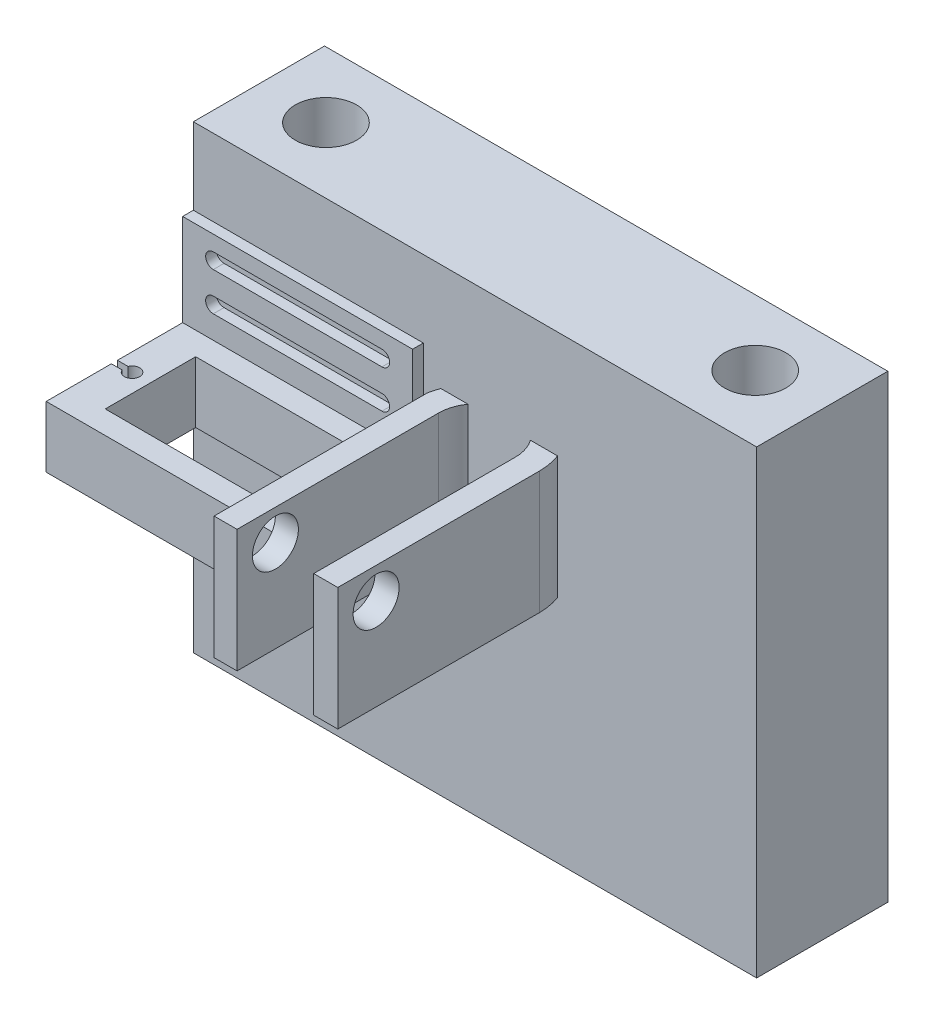
from build123d import *

# Parameters (mm, degrees)
SKETCH1_W                   = 31.9
SKETCH1_H                   = 17.8
SKETCH1_W_2                 = 22.5
SKETCH1_H_2                 = 11.8
BOSS_EXTRUDE1_DEPTH         = 8
BOSS_EXTRUDE2_DEPTH         = 16
SKETCH5_W                   = 14.05
SKETCH5_H                   = 12
SKETCH5_W_2                 = 15.95
SKETCH5_H_2                 = 8
BOSS_EXTRUDE3_DEPTH         = 3
CUT_EXTRUDE2_DEPTH          = 3
CUT_EXTRUDE3_DEPTH          = 43.272216091
BOSS_EXTRUDE4_START         = -8
BOSS_EXTRUDE4_DEPTH         = 8
CUT_EXTRUDE4_DEPTH          = 43.128612605
IZIM1_W                     = 73.483837375
IZIM1_H                     = 17.110844689
IZIM1_R                     = 4
Y_KSEKLIK_EKSTR_ZYON1_DEPTH = 30


with BuildPart() as part:
    # Sketch1 → Boss-Extrude1 (new body)
    with BuildSketch(Plane(origin=(0, 0, 0), x_dir=(1, 0, 0), z_dir=(0, 1, 0))):
        Rectangle(SKETCH1_W, SKETCH1_H)
        Rectangle(SKETCH1_W_2, SKETCH1_H_2, mode=Mode.SUBTRACT)
    extrude(amount=BOSS_EXTRUDE1_DEPTH)

    # Sketch3 → Boss-Extrude2 (add)
    with BuildSketch(Plane.XZ):
        with BuildLine():
            ThreePointArc((28.95, -7.4), (23.95, -12.4), (18.95, -7.4))
            Line((18.95, -7.4), (18.95, 18.9))
            Line((18.95, 18.9), (15.95, 18.9))
            Line((15.95, 18.9), (15.95, -8.9))
            ThreePointArc((15.95, -8.9), (24.70323224, -15.504482784), (32.089410298, -7.4))
            Line((32.089410298, -7.4), (32.089410298, 18.9))
            Line((32.089410298, 18.9), (28.95, 18.9))
            Line((28.95, 18.9), (28.95, -7.4))
        make_face()
    extrude(amount=-BOSS_EXTRUDE2_DEPTH)

    # Sketch5 → Boss-Extrude3 (add)
    with BuildSketch(Plane(origin=(0, 0, -8.9), x_dir=(-1, 0, 0), z_dir=(0, 0, -1))):
        with Locations((-7.025, 14)):
            Rectangle(SKETCH5_W, SKETCH5_H)
        with Locations((7.975, 14)):
            Rectangle(SKETCH5_W_2, SKETCH5_H)
        with Locations((7.975, 4)):
            Rectangle(SKETCH5_W_2, SKETCH5_H_2)
        with Locations((-7.025, 4)):
            Rectangle(SKETCH5_W, SKETCH5_H_2)
    extrude(amount=BOSS_EXTRUDE3_DEPTH)

    # Sketch6 → Cut-Extrude2 (cut)
    with BuildSketch(Plane.XY.offset(-8.9)):
        with BuildLine():
            Line((-11.95, 18), (10.05, 18))
            ThreePointArc((10.05, 18), (11.05, 17), (10.05, 16))
            Line((10.05, 16), (-11.95, 16))
            ThreePointArc((-11.95, 16), (-12.95, 17), (-11.95, 18))
        make_face()
        with BuildLine():
            Line((-11.95, 13), (10.05, 13))
            ThreePointArc((10.05, 13), (11.05, 12), (10.05, 11))
            Line((10.05, 11), (-11.95, 11))
            ThreePointArc((-11.95, 11), (-12.95, 12), (-11.95, 13))
        make_face()
    extrude(amount=-CUT_EXTRUDE2_DEPTH, mode=Mode.SUBTRACT)

    # Sketch7 → Cut-Extrude3 (cut, through all)
    with BuildSketch(Plane.XZ):
        with BuildLine():
            Line((-15.95, -0.393894215), (-15.95, 0.393894215))
            Line((-15.95, 0.393894215), (-14.56915578, 0.393894215))
            ThreePointArc((-14.56915578, 0.393894215), (-12.65, 0), (-14.56915578, -0.393894215))
            Line((-14.56915578, -0.393894215), (-15.95, -0.393894215))
        make_face()
    cut_extrude3 = extrude(amount=-CUT_EXTRUDE3_DEPTH, mode=Mode.SUBTRACT)

    # Mirror1: Cut-Extrude3 across plane
    add(cut_extrude3.mirror(Plane(origin=(0, 0, 0), x_dir=(0, 0, 1), z_dir=(1, 0, 0))), mode=Mode.SUBTRACT)

    # Sketch8 → Boss-Extrude4 (add)
    with BuildSketch(Plane.XZ.offset(BOSS_EXTRUDE4_START)):
        with BuildLine():
            Line((14.05, -11.9), (14.05, -8.9))
            Line((14.05, -8.9), (15.95, -8.9))
            ThreePointArc((15.95, -8.9), (16.408162032, -10.461156655), (17.167670017, -11.9))
            Line((17.167670017, -11.9), (14.05, -11.9))
        make_face()
    extrude(amount=BOSS_EXTRUDE4_DEPTH)

    # Sketch9 → Cut-Extrude4 (cut, through all)
    with BuildSketch(Plane.ZY.offset(-15.95)):
        with BuildLine():
            ThreePointArc((13.9, 15), (10.9, 12), (13.9, 9))
            Line((13.9, 9), (13.9, 15))
        make_face()
        with BuildLine():
            Line((13.9, 15), (13.9, 9))
            ThreePointArc((13.9, 9), (16.021320344, 9.878679656), (16.9, 12))
            ThreePointArc((16.9, 12), (16.021320344, 14.121320344), (13.9, 15))
        make_face()
    extrude(amount=-CUT_EXTRUDE4_DEPTH, mode=Mode.SUBTRACT)

    # Çizim1 → Yükseklik-Ekstrüzyon1 (add, symmetric)
    with BuildSketch(Plane.XZ):
        with Locations((20.791918688, -18.853722133)):
            Rectangle(IZIM1_W, IZIM1_H)
        with Locations(Location((48.791918688, -18.853722132, 0), (0, 0, 90))):
            Circle(IZIM1_R, mode=Mode.SUBTRACT)
        with Locations(Location((-7.208081312, -18.853722132, 0), (0, 0, 90))):
            Circle(IZIM1_R, mode=Mode.SUBTRACT)
    extrude(amount=Y_KSEKLIK_EKSTR_ZYON1_DEPTH, both=True)


solid = part.part
